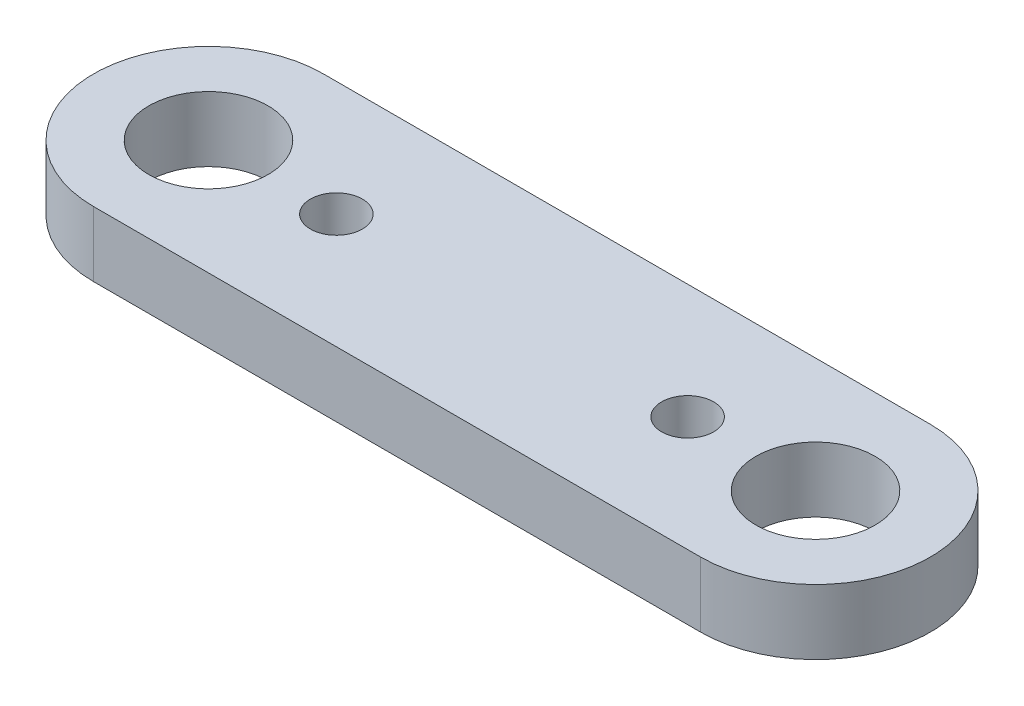
from build123d import *

# Parameters (mm, degrees)
SKETCH_1_R      = 2.75
SKETCH_1_R_2    = 1.2
EXTRUDE_1_DEPTH = 3


with BuildPart() as part:
    # 草图1 → 凸台-拉伸1 (new body)
    with BuildSketch(Plane(origin=(0, 0, 0), x_dir=(1, 0, 0), z_dir=(0, 1, 0))):
        with BuildLine():
            Line((-14, 5.3), (14, 5.3))
            ThreePointArc((14, 5.3), (19.3, 0), (14, -5.3))
            Line((14, -5.3), (-14, -5.3))
            ThreePointArc((-14, -5.3), (-19.3, 0), (-14, 5.3))
        make_face()
        with Locations(Location((-14, 0, 0), (0, 0, 270))):
            Circle(SKETCH_1_R, mode=Mode.SUBTRACT)
        with Locations(Location((14, 0, 0), (0, 0, 90))):
            Circle(SKETCH_1_R, mode=Mode.SUBTRACT)
        with Locations(Location((8.1, 0, 0), (0, 0, 270))):
            Circle(SKETCH_1_R_2, mode=Mode.SUBTRACT)
        with Locations(Location((-8.1, 0, 0), (0, 0, 90))):
            Circle(SKETCH_1_R_2, mode=Mode.SUBTRACT)
    extrude(amount=EXTRUDE_1_DEPTH)


solid = part.part
